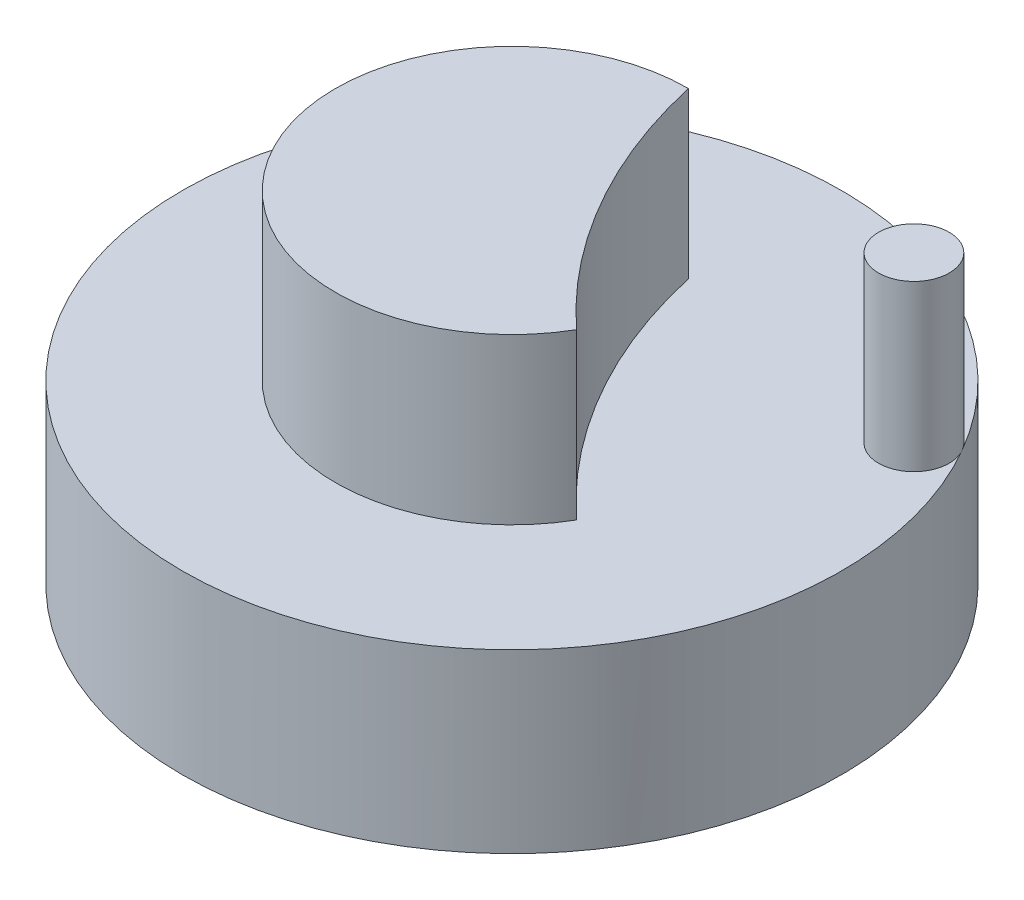
from build123d import *

# Parameters (mm, degrees)
SKETCH1_R             = 6
BOSS_EXTRUDE1_DEPTH   = 28
BOSS_EXTRUDE1_2_DEPTH = 28
SKETCH2_R             = 56
BOSS_EXTRUDE3_DEPTH   = 30
SKETCH3_R             = 15
CUT_EXTRUDE1_DEPTH    = 29


with BuildPart() as part:
    # Sketch1 → Boss-Extrude1 (new body)
    with BuildSketch(Plane(origin=(0, 0, 0), x_dir=(1, 0, 0), z_dir=(0, 1, 0))):
        with Locations(Location((43.301270189, -75, 0), (0, 0, 270))):
            Circle(SKETCH1_R)
    extrude(amount=BOSS_EXTRUDE1_DEPTH)



with BuildPart() as body_2:
    # Sketch1 → Boss-Extrude1 2 (new body)
    with BuildSketch(Plane(origin=(0, 0, 0), x_dir=(1, 0, 0), z_dir=(0, 1, 0))):
        with BuildLine():
            ThreePointArc((0, -70), (9.54447402, -94.489495355), (25.980762114, -115))
            ThreePointArc((25.980762114, -115), (-25.980762114, -115), (0, -70))
        make_face()
    extrude(amount=BOSS_EXTRUDE1_2_DEPTH)


with BuildPart() as part_1:
    add(part.part)

    add(body_2.part)  # Boss-Extrude3 merges body 2
    # Sketch2 → Boss-Extrude3 (add)
    with BuildSketch(Plane(origin=(0, 0, 0), x_dir=(1, 0, 0), z_dir=(0, 1, 0))):
        with Locations(Location((0, -100, 0), (0, 0, 270))):
            Circle(SKETCH2_R)
    extrude(amount=-BOSS_EXTRUDE3_DEPTH)

    # Sketch3 → Cut-Extrude1 (cut)
    with BuildSketch(Plane.XZ.offset(30)):
        with Locations(Location((0, 100, 0), (0, 0, 270))):
            Circle(SKETCH3_R)
    extrude(amount=-CUT_EXTRUDE1_DEPTH, mode=Mode.SUBTRACT)


solid = part_1.part
